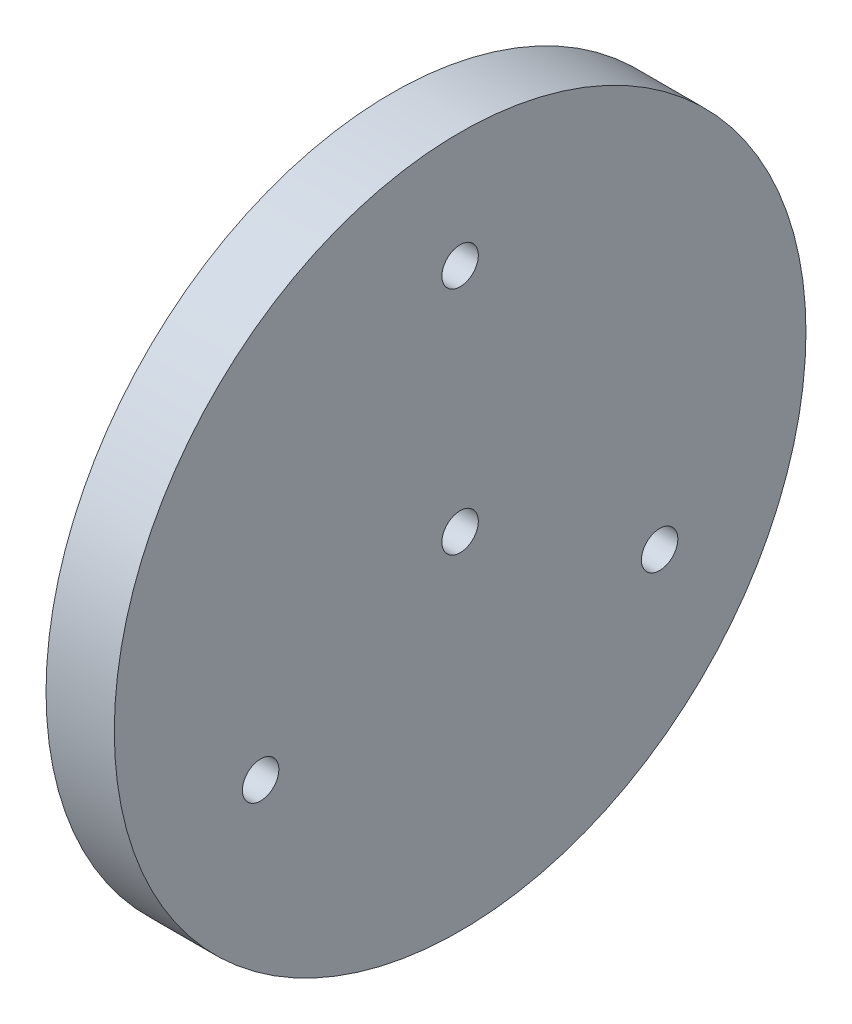
from build123d import *

# Parameters (mm, degrees)
SKETCH1_R           = 76
SKETCH1_R_2         = 4
BOSS_EXTRUDE1_DEPTH = 15


with BuildPart() as part:
    # Sketch1 → Boss-Extrude1 (new body)
    with BuildSketch(Plane(origin=(0, 0, 0), x_dir=(0, 0, -1), z_dir=(1, 0, 0))):
        Circle(SKETCH1_R)
        Circle(SKETCH1_R_2, mode=Mode.SUBTRACT)
        with Locations((0, 50.619572212)):
            Circle(SKETCH1_R_2, mode=Mode.SUBTRACT)
        with Locations((43.837835464, -25.309786106)):
            Circle(SKETCH1_R_2, mode=Mode.SUBTRACT)
        with Locations((-43.837835464, -25.309786106)):
            Circle(SKETCH1_R_2, mode=Mode.SUBTRACT)
    extrude(amount=BOSS_EXTRUDE1_DEPTH)


solid = part.part
